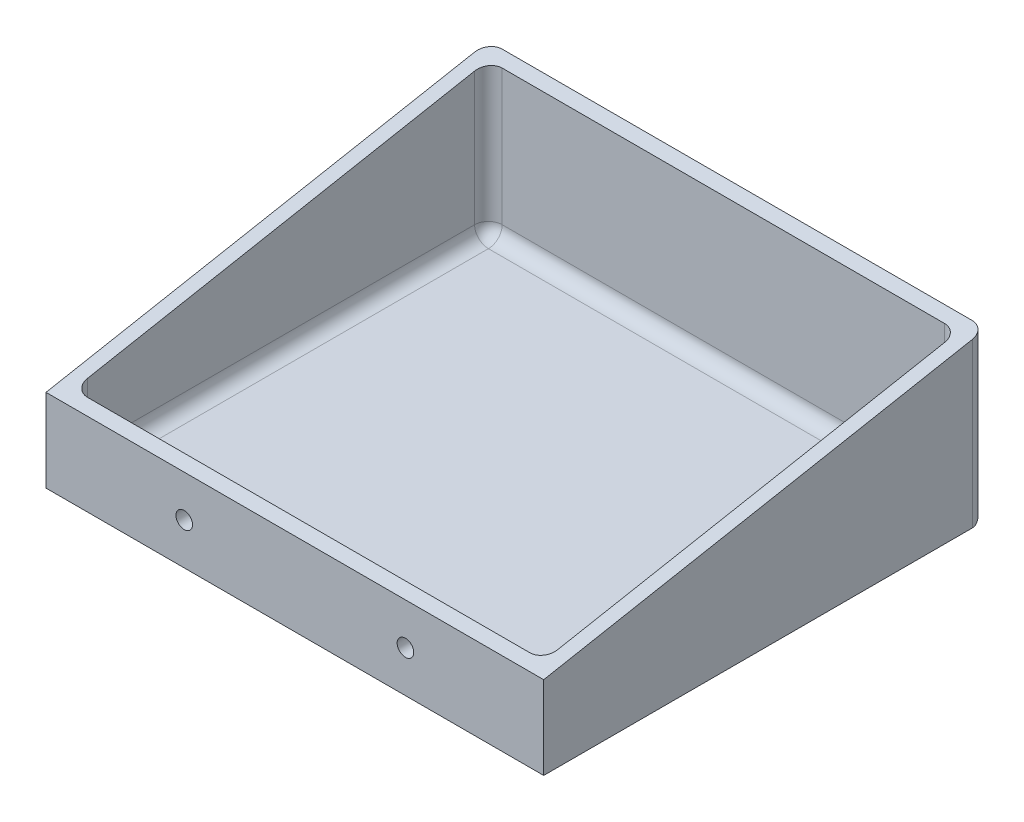
from build123d import *

# Parameters (mm, degrees)
BOSS_EXTRUDE1_DEPTH       = 90
SHELL1_T                  = -2.5
FILLET1_R                 = 2.5
F_3_0MM_DOWEL_HOLE1_D     = 3
F_3_0MM_DOWEL_HOLE1_DEPTH = 2.5


with BuildPart() as part:
    # Sketch2 → Boss-Extrude1 (new body)
    with BuildSketch(Plane(origin=(0, 0, 0), x_dir=(0, 0, -1), z_dir=(1, 0, 0))):
        Polygon((0, 0), (80, 0), (80, 30), (0, 15), align=None)
    extrude(amount=BOSS_EXTRUDE1_DEPTH)

    # Shell1
    shell1_openings = [part.faces().sort_by_distance(p)[0] for p in [
        (45, 22.5, -40),
    ]]
    offset(amount=SHELL1_T, openings=shell1_openings, kind=Kind.INTERSECTION)

    # Fillet1
    fillet1_edges = [part.edges().sort_by_distance(p)[0] for p in [
        (90, 15, -80),
        (2.5, 8.984375, -2.5),
        (2.5, 2.5, -40),
        (45, 2.5, -2.5),
        (2.5, 16.015625, -77.5),
        (45, 2.5, -77.5),
        (87.5, 8.984375, -2.5),
        (87.5, 2.5, -40),
        (87.5, 16.015625, -77.5),
        (0, 15, -80),
        (45, 0, -80),
    ]]
    fillet(fillet1_edges, radius=FILLET1_R)

    # Ø3.0mm Dowel Hole1
    with Locations(Plane.XY):
        with Locations((25, 7.5), (65, 7.5)):
            Hole(F_3_0MM_DOWEL_HOLE1_D / 2, depth=F_3_0MM_DOWEL_HOLE1_DEPTH)


solid = part.part
